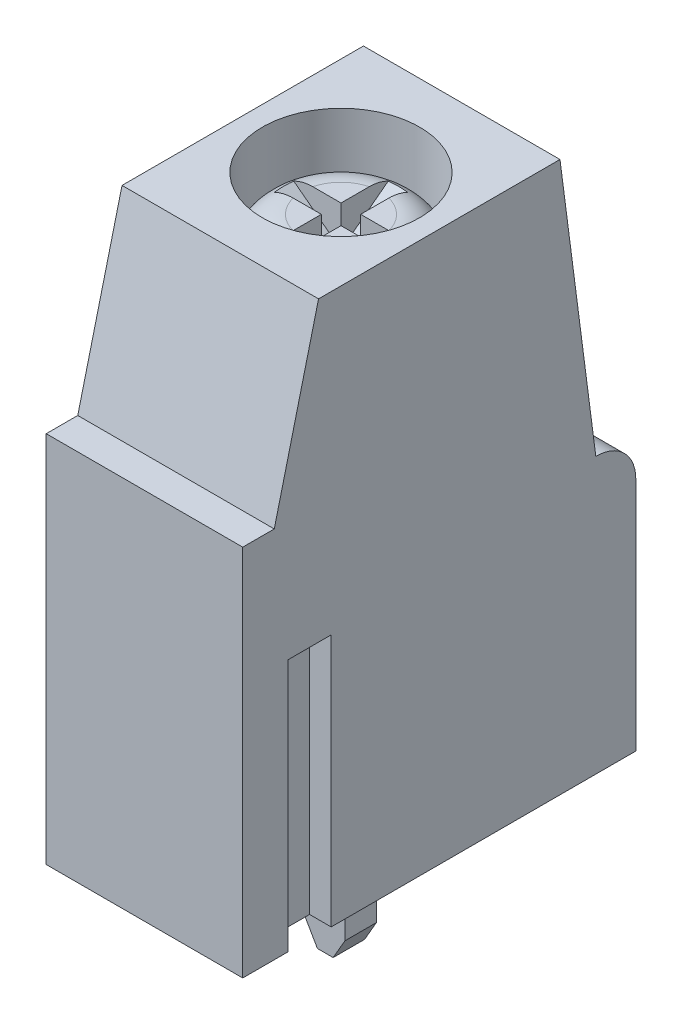
from build123d import *

# Parameters (mm, degrees)
BOSS_EXTRUDE1_DEPTH      = 5
CUT_EXTRUDE_1_DEPTH      = 4
SKETCH_4_R               = 2
CUT_EXTRUDE_2_DEPTH      = 4
CUT_EXTRUDE_START        = 0.25
CUT_EXTRUDE_3_DEPTH      = 0.5
PATTERN_CIRCULAR_2_COUNT = 4
SKETCH_7_W               = 1
SKETCH_7_H               = 6.38564687
EXTRUDE_1_DEPTH          = 0.5
SKETCH_8_W               = 1.1
SKETCH_8_H               = 6.43564687
CUT_EXTRUDE_4_DEPTH      = 0.55
SKETCH_10_W              = 1
SKETCH_10_H              = 0.8
EXTRUDE_2_DEPTH          = 3
CHAMFER_2_SIZE           = 0.3
CHAMFER_2_SIZE2          = 0.519615242
CHAMFER_3_SIZE           = 0.3
CHAMFER_3_SIZE2          = 0.519615242


with BuildPart() as part:
    # Sketch1 → Boss-Extrude1 (new body)
    with BuildSketch(Plane(origin=(0, 0, 0), x_dir=(0, 0, -1), z_dir=(1, 0, 0))):
        with BuildLine():
            Line((8.071293529, 14), (8.983255455, 7))
            Line((8.983255455, 7), (9, 7))
            ThreePointArc((9, 7), (9.707106781, 6.707106781), (10, 6))
            Line((10, 6), (10, 0))
            Line((10, 0), (0, 0))
            Line((0, 0), (0, 9.493570114))
            Line((0, 9.493570114), (0.802161187, 9.493570114))
            Line((0.802161187, 9.493570114), (1.928706471, 14))
            Line((1.928706471, 14), (8.071293529, 14))
        make_face()
    extrude(amount=BOSS_EXTRUDE1_DEPTH)

    # Эскиз2 → Вырез-Вытянуть1 (cut)
    with BuildSketch(Plane.ZY.offset(-0.5)):
        Polygon((-10, 5.692040605), (-8.656873738, 5.046895275), (-2.931105615, 5.046895275), (-2.931105615, 0.968562632), (-8.400228705, 0.968562632), (-10, 0.542354651), align=None)
    extrude(amount=-CUT_EXTRUDE_1_DEPTH, mode=Mode.SUBTRACT)

    # Эскиз4 → Вырез-Вытянуть2 (cut)
    with BuildSketch(Plane(origin=(0, 14, 0), x_dir=(1, 0, 0), z_dir=(0, 1, 0))):
        with Locations((2.5, 5)):
            Circle(SKETCH_4_R)
    extrude(amount=-CUT_EXTRUDE_2_DEPTH, mode=Mode.SUBTRACT)

    # Эскиз5 → Повернуть1 (revolve)
    with BuildSketch(Plane.ZY.offset(-2.5)):
        with BuildLine():
            Line((-5, 13.076817247), (-6, 13.076817247))
            ThreePointArc((-6, 13.076817247), (-6.707106781, 12.783924028), (-7, 12.076817247))
            Line((-7, 12.076817247), (-7, 11.356355107))
            Line((-7, 11.356355107), (-5, 11.356355107))
            Line((-5, 11.356355107), (-5, 13.076817247))
        make_face()
    revolve(axis=Axis((2.5, 13.076817247, -5), (0, -1, 0)))

    # Эскиз6 → Вырез-Вытянуть3 (cut)
    with BuildSketch(Plane.ZY.offset(-2.5).offset(CUT_EXTRUDE_START)):
        Polygon((-6.758727889, 13.191820369), (-5, 13.191820369), (-5, 12.042931868), (-5.25, 12.042931868), align=None)
    cut_extrude_3 = extrude(amount=-CUT_EXTRUDE_3_DEPTH, mode=Mode.SUBTRACT)

    # Круговой массив2: Вырез-Вытянуть3 ×4 about axis
    pattern_circular_2_axis = Axis((2.5, -0.7, -5), (0, 1, 0))
    for i in range(1, PATTERN_CIRCULAR_2_COUNT):
        add(cut_extrude_3.rotate(pattern_circular_2_axis, i * 360 / PATTERN_CIRCULAR_2_COUNT), mode=Mode.SUBTRACT)

    # Эскиз7 → Бобышка-Вытянуть1 (add)
    with BuildSketch(Plane.ZY):
        with Locations((-1.7, 3.192823435)):
            Rectangle(SKETCH_7_W, SKETCH_7_H)
    extrude(amount=EXTRUDE_1_DEPTH)

    # Эскиз8 → Вырез-Вытянуть4 (cut)
    with BuildSketch(Plane(origin=(5, 0, 0), x_dir=(0, 0, -1), z_dir=(1, 0, 0))):
        with Locations((1.7, 3.217823435)):
            Rectangle(SKETCH_8_W, SKETCH_8_H)
    extrude(amount=-CUT_EXTRUDE_4_DEPTH, mode=Mode.SUBTRACT)

    # Эскиз10 → Бобышка-Вытянуть2 (add)
    with BuildSketch(Plane(origin=(0, 0, 0), x_dir=(-1, 0, 0), z_dir=(0, -1, 0))):
        with Locations((-2.5, 5)):
            Rectangle(SKETCH_10_W, SKETCH_10_H)
    extrude(amount=EXTRUDE_2_DEPTH)

    # Фаска2
    chamfer_2_edges = [part.edges().sort_by_distance(p)[0] for p in [
        (2, -3, -5),
    ]]
    chamfer_2_side = [part.faces().sort_by_distance(p)[0] for p in [
        (2.5, -3, -5),
    ]]
    chamfer(chamfer_2_edges, length=CHAMFER_2_SIZE, length2=CHAMFER_2_SIZE2, reference=chamfer_2_side[0])

    # Фаска3
    chamfer_3_edges = [part.edges().sort_by_distance(p)[0] for p in [
        (3, -3, -5),
    ]]
    chamfer_3_side = [part.faces().sort_by_distance(p)[0] for p in [
        (2.65, -3, -5),
    ]]
    chamfer(chamfer_3_edges, length=CHAMFER_3_SIZE, length2=CHAMFER_3_SIZE2, reference=chamfer_3_side[0])


solid = part.part
